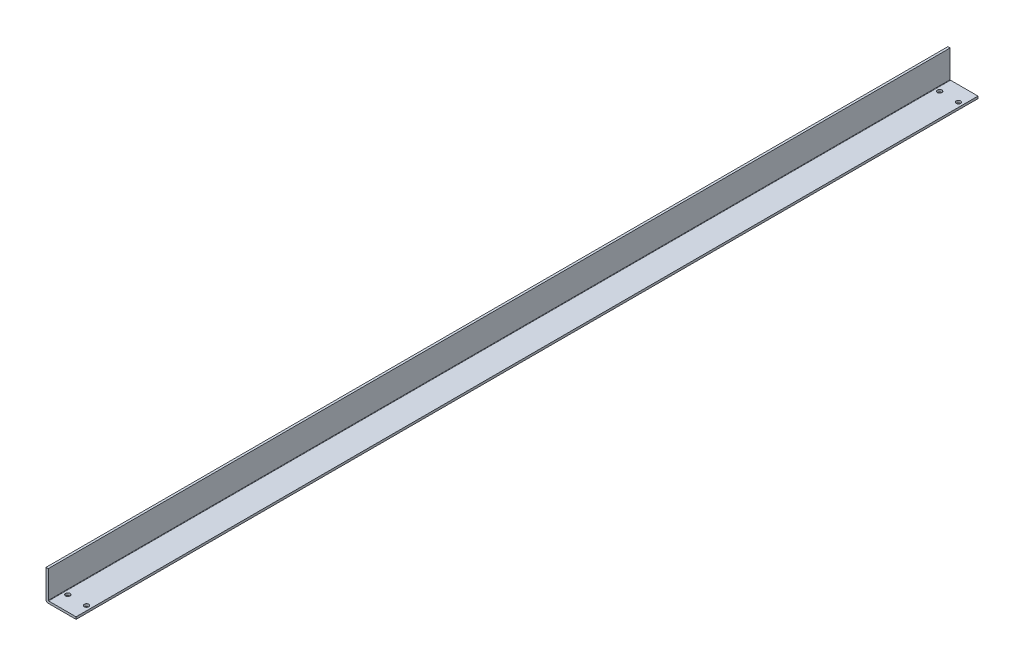
from build123d import *

# Parameters (mm, degrees)
BOSS_EXTRUDE1_DEPTH = 1200
CUT_EXTRUDE1_REACH  = 1203.236
SKETCH2_R           = 3


with BuildPart() as part:
    # Sketch1 → Boss-Extrude1 (new body)
    with BuildSketch(Plane.XY):
        with BuildLine():
            Line((0, 3), (0, 40))
            Line((0, 40), (3, 40))
            Line((3, 40), (3, 3.5))
            ThreePointArc((3, 3.5), (3.146446609, 3.146446609), (3.5, 3))
            Line((3.5, 3), (40, 3))
            Line((40, 3), (40, 0))
            Line((40, 0), (3, 0))
            ThreePointArc((3, 0), (0.878679656, 0.878679656), (0, 3))
        make_face()
    extrude(amount=BOSS_EXTRUDE1_DEPTH)

    # Sketch2 → Cut-Extrude1 (cut, up to next)
    with BuildSketch(Plane(origin=(0, 3, 0), x_dir=(1, 0, 0), z_dir=(0, 1, 0)), mode=Mode.PRIVATE) as cut_extrude1_sk1:
        with Locations(Location((9, -1180, 0), (0, 0, 270))):
            Circle(SKETCH2_R)
    cut_extrude1_tool1 = extrude(cut_extrude1_sk1.sketch, amount=-CUT_EXTRUDE1_REACH, mode=Mode.PRIVATE) & part.part
    # Sketch2 → Cut-Extrude1 (cut, up to next)
    with BuildSketch(Plane(origin=(0, 3, 0), x_dir=(1, 0, 0), z_dir=(0, 1, 0)), mode=Mode.PRIVATE) as cut_extrude1_sk2:
        with Locations(Location((34, -1180, 0), (0, 0, 270))):
            Circle(SKETCH2_R)
    cut_extrude1_tool2 = extrude(cut_extrude1_sk2.sketch, amount=-CUT_EXTRUDE1_REACH, mode=Mode.PRIVATE) & part.part
    # Sketch2 → Cut-Extrude1 (cut, up to next)
    with BuildSketch(Plane(origin=(0, 3, 0), x_dir=(1, 0, 0), z_dir=(0, 1, 0)), mode=Mode.PRIVATE) as cut_extrude1_sk3:
        with Locations(Location((9, -20, 0), (0, 0, 270))):
            Circle(SKETCH2_R)
    cut_extrude1_tool3 = extrude(cut_extrude1_sk3.sketch, amount=-CUT_EXTRUDE1_REACH, mode=Mode.PRIVATE) & part.part
    # Sketch2 → Cut-Extrude1 (cut, up to next)
    with BuildSketch(Plane(origin=(0, 3, 0), x_dir=(1, 0, 0), z_dir=(0, 1, 0)), mode=Mode.PRIVATE) as cut_extrude1_sk4:
        with Locations(Location((34, -20, 0), (0, 0, 270))):
            Circle(SKETCH2_R)
    cut_extrude1_tool4 = extrude(cut_extrude1_sk4.sketch, amount=-CUT_EXTRUDE1_REACH, mode=Mode.PRIVATE) & part.part
    add(cut_extrude1_tool1.solids().sort_by_distance((9, 3, 1180))[0], mode=Mode.SUBTRACT)
    add(cut_extrude1_tool2.solids().sort_by_distance((34, 3, 1180))[0], mode=Mode.SUBTRACT)
    add(cut_extrude1_tool3.solids().sort_by_distance((9, 3, 20))[0], mode=Mode.SUBTRACT)
    add(cut_extrude1_tool4.solids().sort_by_distance((34, 3, 20))[0], mode=Mode.SUBTRACT)


solid = part.part
